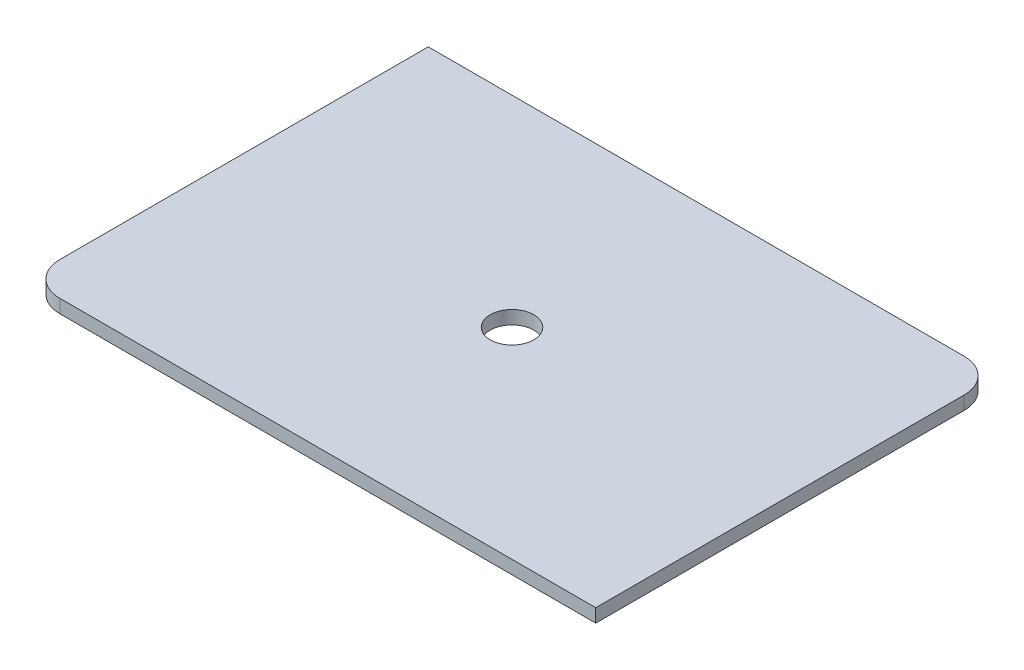
from build123d import *

# Parameters (mm, degrees)
BOSS_EXTRUDE1_DEPTH = 4
CUT_EXTRUDE1_REACH  = 106.12
SKETCH3_R           = 6.5


with BuildPart() as part:
    # Sketch2 → Boss-Extrude1 (new body)
    with BuildSketch(Plane(origin=(0, 0, 0), x_dir=(1, 0, 0), z_dir=(0, 1, 0))):
        with BuildLine():
            Line((75, 60), (-85, 60))
            Line((-85, 60), (-85, -50))
            ThreePointArc((-85, -50), (-82.071067812, -57.071067812), (-75, -60))
            Line((-75, -60), (85, -60))
            Line((85, -60), (85, 50))
            ThreePointArc((85, 50), (82.071067812, 57.071067812), (75, 60))
        make_face()
    extrude(amount=-BOSS_EXTRUDE1_DEPTH)

    # Sketch3 → Cut-Extrude1 (cut, up to next)
    with BuildSketch(Plane(origin=(0, 0, 0), x_dir=(1, 0, 0), z_dir=(0, 1, 0)), mode=Mode.PRIVATE) as cut_extrude1_sk1:
        with Locations(Location((0, 0, 0), (0, 0, 270))):
            Circle(SKETCH3_R)
    cut_extrude1_tool1 = extrude(cut_extrude1_sk1.sketch, amount=-CUT_EXTRUDE1_REACH, mode=Mode.PRIVATE) & part.part
    add(cut_extrude1_tool1.solids().sort_by_distance((0, 0, 0))[0], mode=Mode.SUBTRACT)


solid = part.part
